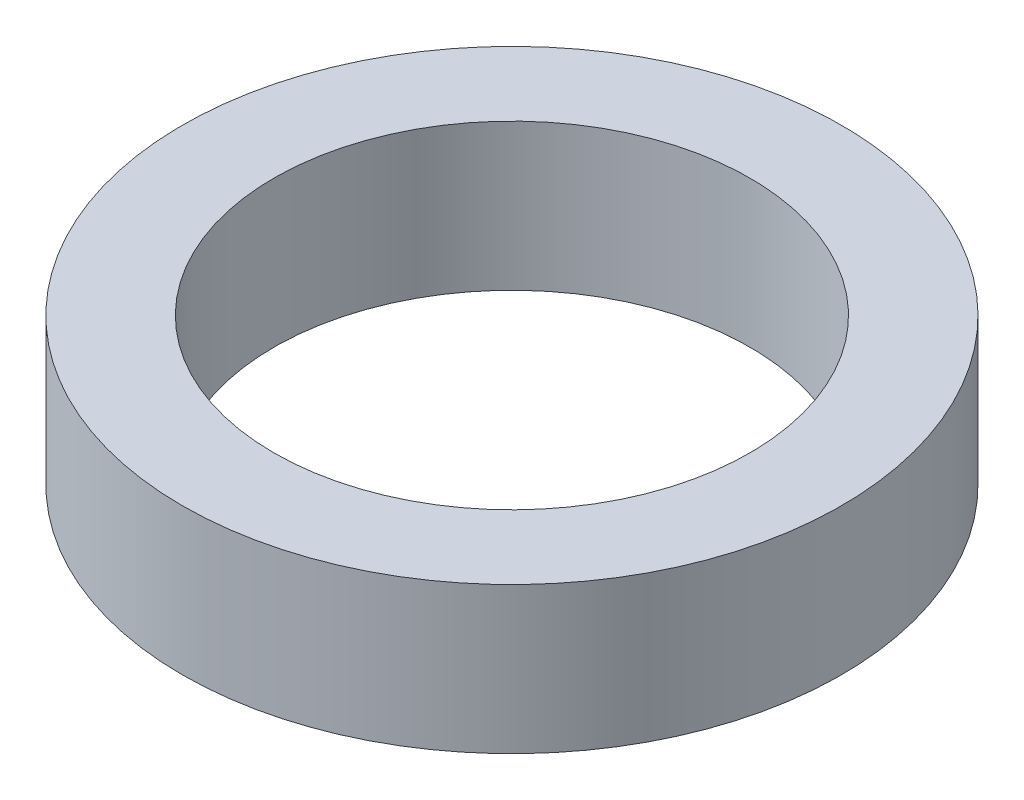
from build123d import *

# Parameters (mm, degrees)
SKETCH1_R           = 9
SKETCH1_R_2         = 6.5
BOSS_EXTRUDE1_DEPTH = 4


with BuildPart() as part:
    # Sketch1 → Boss-Extrude1 (new body)
    with BuildSketch(Plane(origin=(0, 0, 0), x_dir=(1, 0, 0), z_dir=(0, 1, 0))):
        with Locations(Location((0, 0, 0), (0, 0, 270))):
            Circle(SKETCH1_R)
        with Locations(Location((0, 0, 0), (0, 0, 270))):
            Circle(SKETCH1_R_2, mode=Mode.SUBTRACT)
    extrude(amount=BOSS_EXTRUDE1_DEPTH)


solid = part.part
